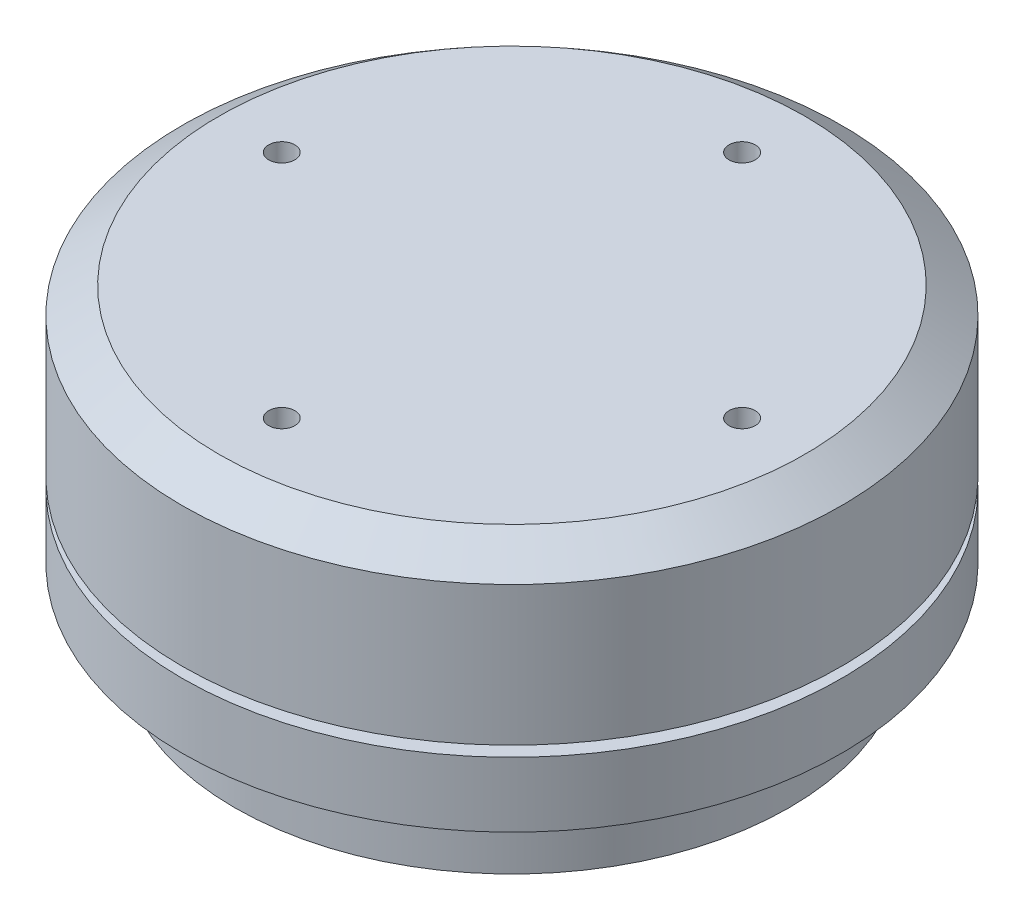
from build123d import *

# Parameters (mm, degrees)
M3X0_5_TAPPED_HOLE1_D     = 2.5
M3X0_5_TAPPED_HOLE1_DEPTH = 6
M3X0_5_TAPPED_HOLE1_TIP   = 0.751075774
M3X0_5_TAPPED_HOLE2_D     = 2.5
M3X0_5_TAPPED_HOLE2_DEPTH = 8.5
M3X0_5_TAPPED_HOLE2_TIP   = 0.751075774


with BuildPart() as part:
    # Sketch1 → Revolve1 (revolve)
    with BuildSketch(Plane.XY):
        Polygon((0, 0), (0, 30), (-28, 30), (-31.5, 27.5), (-31.5, 14.2), (-29.5, 14.2), (-29.5, 13.2), (-31.5, 13.2), (-31.5, 7), (-26.5, 5.6), (-26.5, 0), align=None)
    revolve(axis=Axis((0, 0, 0), (0, -1, 0)))

    # M3x0.5 Tapped Hole1
    with Locations(Plane(origin=(0, 30, 0), x_dir=(1, 0, 0), z_dir=(0, 1, 0))):
        with Locations((0, 22), (0, -22), (22, 0), (-22, 0)):
            Hole(M3X0_5_TAPPED_HOLE1_D / 2, depth=M3X0_5_TAPPED_HOLE1_DEPTH)
            with Locations((0, 0, -(M3X0_5_TAPPED_HOLE1_DEPTH + M3X0_5_TAPPED_HOLE1_TIP / 2))):  # 118° drill point
                Cone(0, M3X0_5_TAPPED_HOLE1_D / 2, M3X0_5_TAPPED_HOLE1_TIP, mode=Mode.SUBTRACT)

    # M3x0.5 Tapped Hole2
    with Locations(Plane(origin=(0, 0, 0), x_dir=(-1, 0, 0), z_dir=(0, -1, 0))):
        with Locations((0, 15), (0, -15), (15, 0), (-15, 0)):
            Hole(M3X0_5_TAPPED_HOLE2_D / 2, depth=M3X0_5_TAPPED_HOLE2_DEPTH)
            with Locations((0, 0, -(M3X0_5_TAPPED_HOLE2_DEPTH + M3X0_5_TAPPED_HOLE2_TIP / 2))):  # 118° drill point
                Cone(0, M3X0_5_TAPPED_HOLE2_D / 2, M3X0_5_TAPPED_HOLE2_TIP, mode=Mode.SUBTRACT)


solid = part.part
